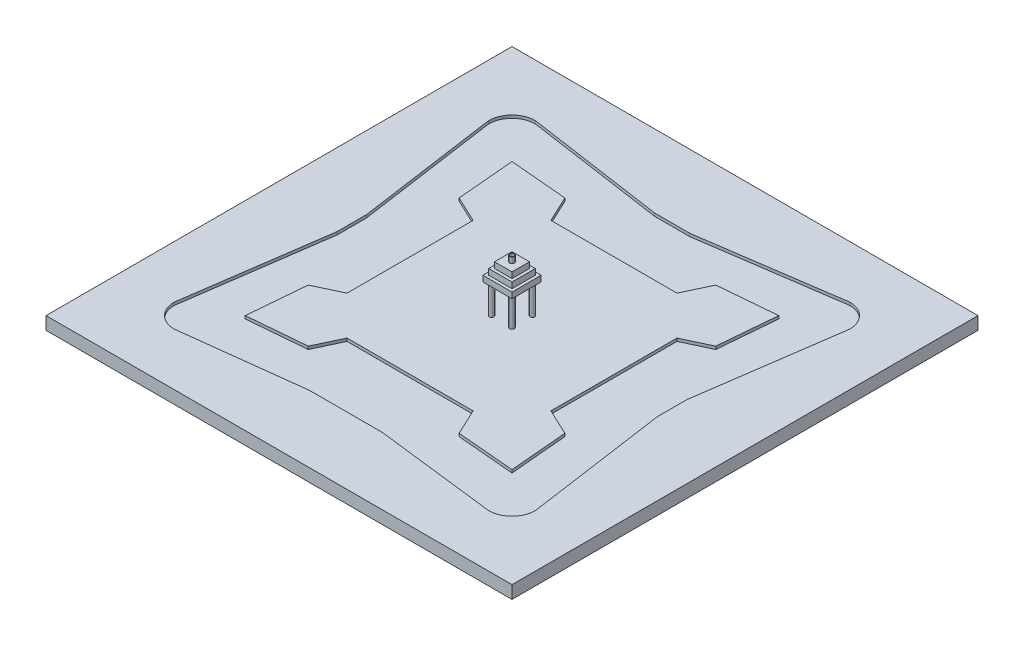
from build123d import *

# Parameters (mm, degrees)
SKETCH1_W           = 8000
SKETCH1_H           = 8000
GROUND_FLOOR_DEPTH  = 220
MOAT_DEPTH          = 50
CITADEL_DEPTH       = 50
SKETCH6_R           = 40
BOSS_EXTRUDE1_DEPTH = 500
SKETCH7_W           = 500
SKETCH7_H           = 500
BOSS_EXTRUDE2_DEPTH = 100
SKETCH8_W           = 400
SKETCH8_H           = 400
BOSS_EXTRUDE3_DEPTH = 100
SKETCH9_W           = 300
SKETCH9_H           = 300
BOSS_EXTRUDE4_DEPTH = 100
SKETCH10_R          = 40
SKETCH10_R_2        = 35
BOSS_EXTRUDE5_DEPTH = 100


with BuildPart() as part:
    # Sketch1 → Ground Floor (new body)
    with BuildSketch(Plane(origin=(0, 0, 0), x_dir=(1, 0, 0), z_dir=(0, 1, 0))):
        Rectangle(SKETCH1_W, SKETCH1_H)
    extrude(amount=GROUND_FLOOR_DEPTH)

    # Sketch2 → Moat (cut)
    with BuildSketch(Plane(origin=(0, 220, 0), x_dir=(1, 0, 0), z_dir=(0, 1, 0))):
        with BuildLine():
            Line((-625, -2850), (625, -2850))
            Line((625, -2850), (2700, -3100))
            ThreePointArc((2700, -3100), (2982.842712475, -2982.842712475), (3100, -2700))
            Line((3100, -2700), (2750, -250))
            Line((2750, -250), (2750, 250))
            Line((2750, 250), (3100, 2700))
            ThreePointArc((3100, 2700), (2982.842712475, 2982.842712475), (2700, 3100))
            Line((2700, 3100), (300, 2750))
            Line((300, 2750), (-300, 2750))
            Line((-300, 2750), (-2700, 3100))
            ThreePointArc((-2700, 3100), (-2982.842712475, 2982.842712475), (-3100, 2700))
            Line((-3100, 2700), (-2750, 250))
            Line((-2750, 250), (-2750, -250))
            Line((-2750, -250), (-3100, -2700))
            ThreePointArc((-3100, -2700), (-2982.842712475, -2982.842712475), (-2700, -3100))
            Line((-2700, -3100), (-625, -2850))
        make_face()
    extrude(amount=-MOAT_DEPTH, mode=Mode.SUBTRACT)

    # Sketch3 → Citadel (add)
    with BuildSketch(Plane(origin=(0, 170, 0), x_dir=(1, 0, 0), z_dir=(0, 1, 0))):
        Polygon((-2290, -2290), (-1295, -2203), (-1082.5, -1750), (0, -1750), (1082.5, -1750), (1295, -2203), (2290, -2290), (2203, -1295), (1750, -1082.5), (1750, 0), (1750, 1082.5), (2203, 1295), (2290, 2290), (1295, 2203), (1082.5, 1750), (0, 1750), (-1082.5, 1750), (-1295, 2203), (-2290, 2290), (-2203, 1295), (-1750, 1082.5), (-1750, 0), (-1750, -1082.5), (-2203, -1295), align=None)
    extrude(amount=CITADEL_DEPTH)

    # Sketch6 → Boss-Extrude1 (add)
    with BuildSketch(Plane(origin=(0, 220, 0), x_dir=(1, 0, 0), z_dir=(0, 1, 0))):
        with Locations(Location((-175, -175, 0), (0, 0, 90))):
            Circle(SKETCH6_R)
        with Locations(Location((-175, 175, 0), (0, 0, 90))):
            Circle(SKETCH6_R)
        with Locations(Location((175, 175, 0), (0, 0, 90))):
            Circle(SKETCH6_R)
        with Locations(Location((175, -175, 0), (0, 0, 90))):
            Circle(SKETCH6_R)
    extrude(amount=BOSS_EXTRUDE1_DEPTH)


with BuildPart() as body_2:
    # Sketch7 → Boss-Extrude2 (new body)
    with BuildSketch(Plane(origin=(0, 720, 0), x_dir=(1, 0, 0), z_dir=(0, 1, 0))):
        Rectangle(SKETCH7_W, SKETCH7_H)
    extrude(amount=BOSS_EXTRUDE2_DEPTH)

    # Sketch8 → Boss-Extrude3 (add)
    with BuildSketch(Plane(origin=(0, 820, 0), x_dir=(1, 0, 0), z_dir=(0, 1, 0))):
        Rectangle(SKETCH8_W, SKETCH8_H)
    extrude(amount=BOSS_EXTRUDE3_DEPTH)

    # Sketch9 → Boss-Extrude4 (add)
    with BuildSketch(Plane(origin=(0, 920, 0), x_dir=(1, 0, 0), z_dir=(0, 1, 0))):
        Rectangle(SKETCH9_W, SKETCH9_H)
    extrude(amount=BOSS_EXTRUDE4_DEPTH)

    # Sketch10 → Boss-Extrude5 (add)
    with BuildSketch(Plane(origin=(0, 1020, 0), x_dir=(1, 0, 0), z_dir=(0, 1, 0))):
        with Locations(Location((0, 0, 0), (0, 0, 90))):
            Circle(SKETCH10_R)
        with Locations(Location((0, 0, 0), (0, 0, 270))):
            Circle(SKETCH10_R_2, mode=Mode.SUBTRACT)
    extrude(amount=BOSS_EXTRUDE5_DEPTH)


solid = Compound([part.part, body_2.part])
